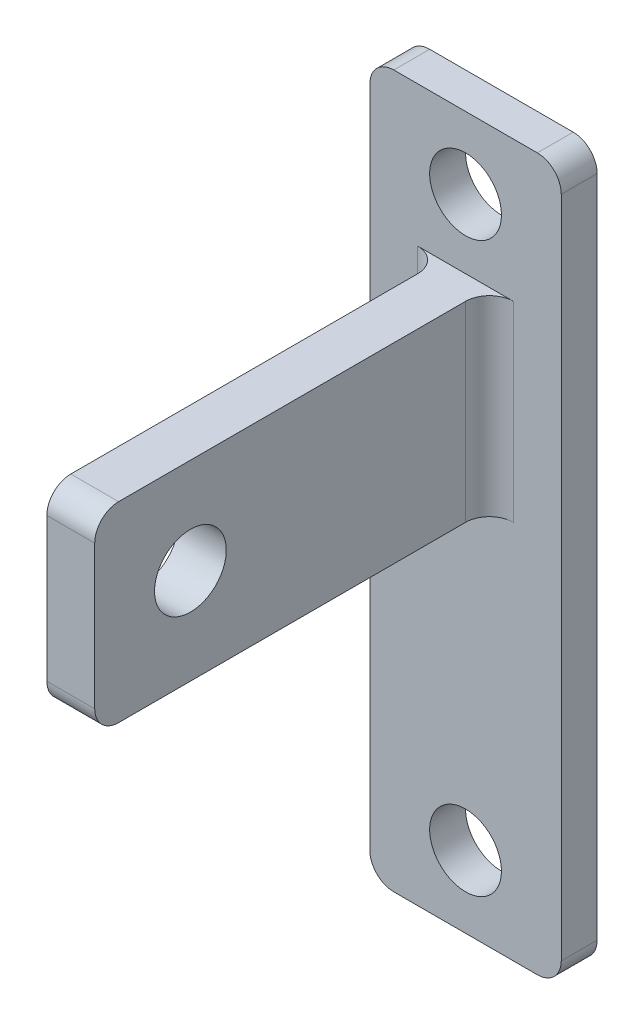
from build123d import *

# Parameters (mm, degrees)
SKETCH_1_W          = 8
SKETCH_1_H          = 29.75
SKETCH_1_R          = 1.5
EXTRUDE_1_DEPTH     = 1.5
SKETCH_2_W          = 2
SKETCH_2_H          = 8
EXTRUDE_2_DEPTH     = 16.5
FILLET_1_R          = 1
FILLET_2_R          = 1
SKETCH_4_R          = 1.5
CUT_EXTRUDE_1_DEPTH = 2


with BuildPart() as part:
    # 草图1 → 凸台-拉伸1 (new body)
    with BuildSketch(Plane.XY):
        Rectangle(SKETCH_1_W, SKETCH_1_H)
        with Locations((0, 11.875)):
            Circle(SKETCH_1_R, mode=Mode.SUBTRACT)
        with Locations((0, -11.875)):
            Circle(SKETCH_1_R, mode=Mode.SUBTRACT)
    extrude(amount=EXTRUDE_1_DEPTH)

    # 草图2 → 凸台-拉伸2 (add)
    with BuildSketch(Plane.XY.offset(1.5)):
        with Locations((0, 5)):
            Rectangle(SKETCH_2_W, SKETCH_2_H)
    extrude(amount=EXTRUDE_2_DEPTH)

    # 圆角1
    fillet_1_edges = [part.edges().sort_by_distance(p)[0] for p in [
        (1, 5, 1.5),
        (-1, 5, 1.5),
    ]]
    fillet(fillet_1_edges, radius=FILLET_1_R)

    # 圆角2
    fillet_2_edges = [part.edges().sort_by_distance(p)[0] for p in [
        (0, 9, 18),
        (0, 1, 18),
        (4, -14.875, 0.75),
        (-4, -14.875, 0.75),
        (-4, 14.875, 0.75),
        (4, 14.875, 0.75),
    ]]
    fillet(fillet_2_edges, radius=FILLET_2_R)

    # 草图4 → 切除-拉伸1 (cut)
    with BuildSketch(Plane.ZY.offset(1)):
        with Locations((14, 5)):
            Circle(SKETCH_4_R)
    extrude(amount=-CUT_EXTRUDE_1_DEPTH, mode=Mode.SUBTRACT)


solid = part.part
